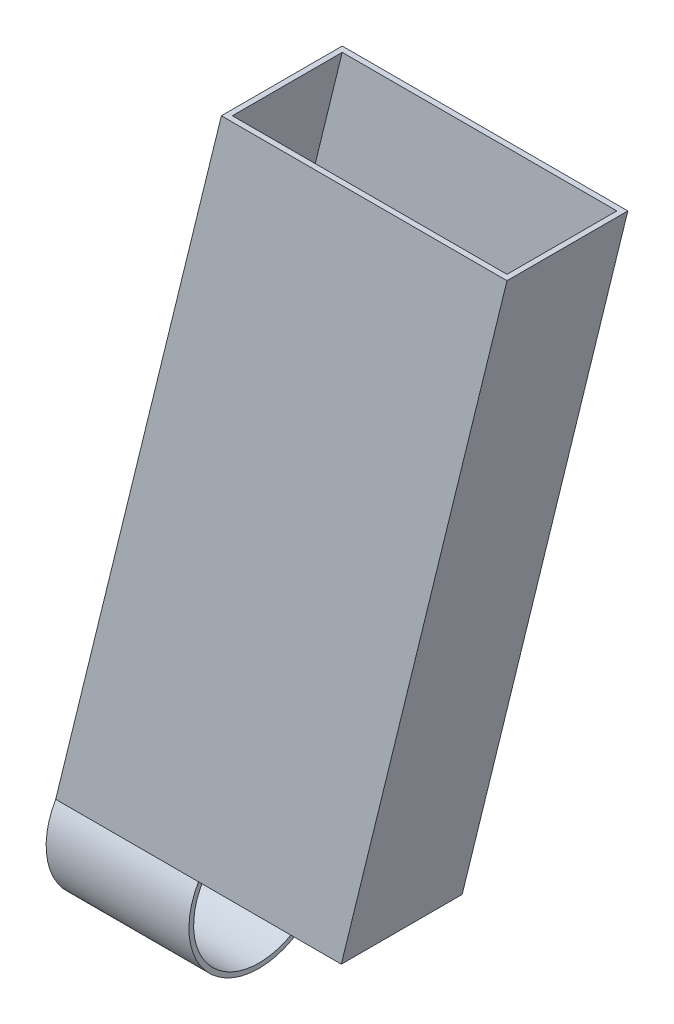
from build123d import *

# Parameters (mm, degrees)
SKETCH_1_W      = 26
SKETCH_1_H      = 11
SKETCH_1_W_2    = 25
SKETCH_1_H_2    = 10
EXTRUDE_1_DEPTH = 13


with BuildPart() as part:
    # 扫描1: sweep along a path in 草图2
    with BuildLine(Plane.XY) as sweep_1_path:
        Line((0, 0), (15.081446117, 61.427097956))
    # 草图1 → 扫描1 (sweep)
    with BuildSketch(Plane(origin=(0, 0, 0), x_dir=(1, 0, 0), z_dir=(0, 1, 0))):
        Rectangle(SKETCH_1_W, SKETCH_1_H)
        Rectangle(SKETCH_1_W_2, SKETCH_1_H_2, mode=Mode.SUBTRACT)
    sweep(path=sweep_1_path.line)

    # 草图3 → 凸台-拉伸1 (add)
    with BuildSketch(Plane(origin=(0, 0, 0), x_dir=(0, 0, -1), z_dir=(1, 0, 0))):
        with BuildLine():
            Line((-5.5, 0), (-5, 0))
            ThreePointArc((-5, 0), (0, -9.160017332), (5, 0))
            Line((5, 0), (5.5, 0))
            ThreePointArc((5.5, 0), (0, -9.586307333), (-5.5, 0))
        make_face()
    extrude(amount=-EXTRUDE_1_DEPTH)


solid = part.part
